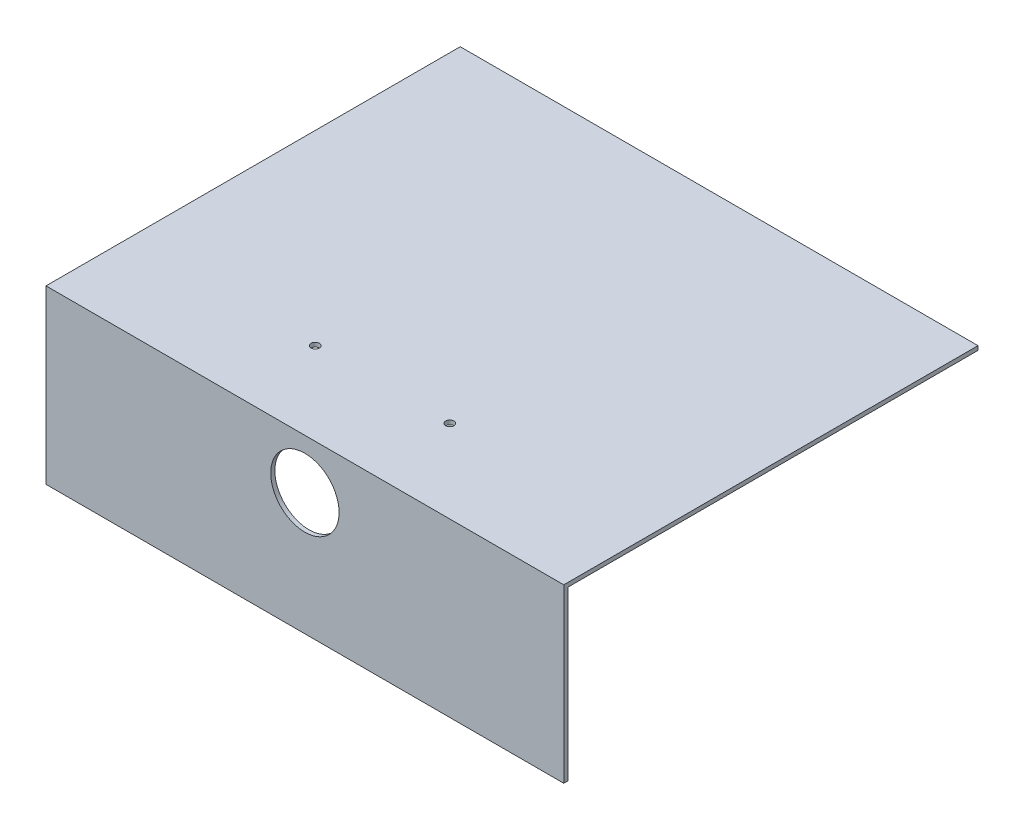
from build123d import *

# Parameters (mm, degrees)
SKETCH1_W           = 250
SKETCH1_H           = 200
BOSS_EXTRUDE1_DEPTH = 2
SKETCH2_W           = 250
SKETCH2_H           = 2
BOSS_EXTRUDE2_DEPTH = 81
SKETCH3_R           = 2
CUT_EXTRUDE1_DEPTH  = 331.740079216
CUT_EXTRUDE2_REACH  = 332.244
SKETCH4_R           = 16.5


with BuildPart() as part:
    # Sketch1 → Boss-Extrude1 (new body)
    with BuildSketch(Plane(origin=(0, 0, 0), x_dir=(1, 0, 0), z_dir=(0, 1, 0))):
        with Locations((125, 100)):
            Rectangle(SKETCH1_W, SKETCH1_H)
    extrude(amount=BOSS_EXTRUDE1_DEPTH)

    # Sketch2 → Boss-Extrude2 (add)
    with BuildSketch(Plane.XZ):
        with Locations((125, -1)):
            Rectangle(SKETCH2_W, SKETCH2_H)
    extrude(amount=BOSS_EXTRUDE2_DEPTH)

    # Sketch3 → Cut-Extrude1 (cut, through all)
    with BuildSketch(Plane(origin=(0, 2, 0), x_dir=(1, 0, 0), z_dir=(0, 1, 0))):
        with Locations(Location((155, 40, 0), (0, 0, 270))):
            Circle(SKETCH3_R)
        with Locations(Location((90, 40, 0), (0, 0, 270))):
            Circle(SKETCH3_R)
    extrude(amount=-CUT_EXTRUDE1_DEPTH, mode=Mode.SUBTRACT)

    # Sketch4 → Cut-Extrude2 (cut, up to next)
    with BuildSketch(Plane.XY, mode=Mode.PRIVATE) as cut_extrude2_sk1:
        with Locations((125, -22)):
            Circle(SKETCH4_R)
    cut_extrude2_tool1 = extrude(cut_extrude2_sk1.sketch, amount=-CUT_EXTRUDE2_REACH, mode=Mode.PRIVATE) & part.part
    add(cut_extrude2_tool1.solids().sort_by_distance((125, -22, 0))[0], mode=Mode.SUBTRACT)


solid = part.part
